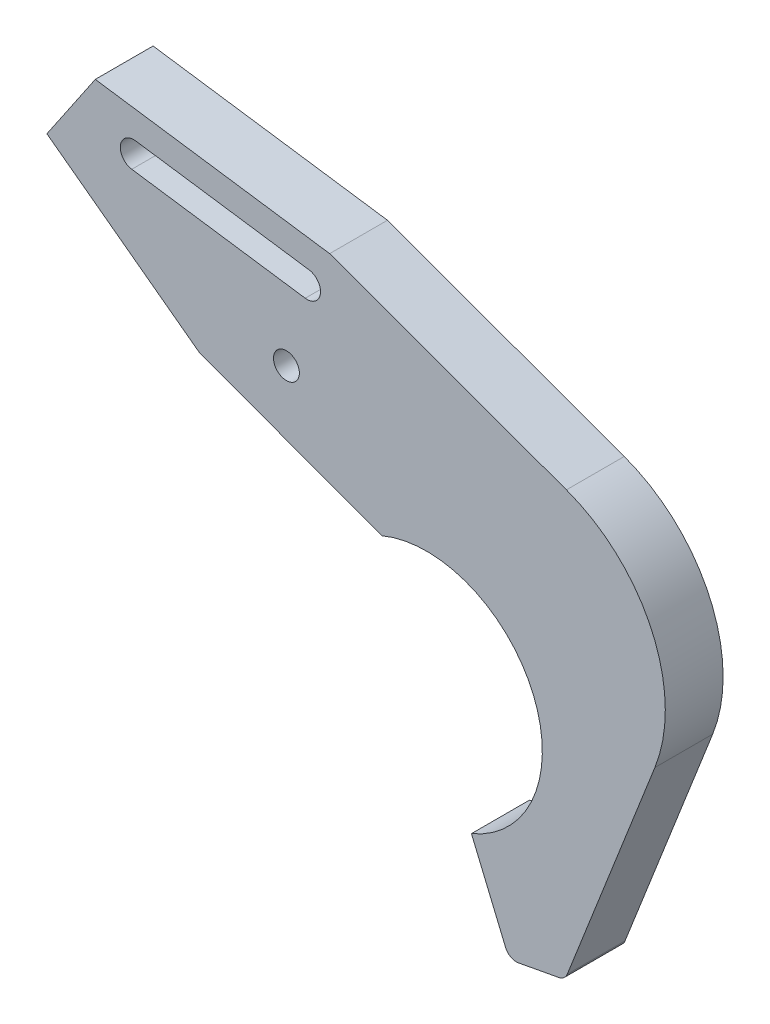
from build123d import *

# Parameters (mm, degrees)
SKETCH1_R           = 2.838382548
BOSS_EXTRUDE2_DEPTH = 12.7
FILLET5_R           = 33.02
FILLET7_R           = 2.54


with BuildPart() as part:
    # Sketch1 → Boss-Extrude2 (new body)
    with BuildSketch(Plane.XY):
        with BuildLine():
            Line((-21.603638559, 84.96960614), (29.87982891, 77.564224626))
            Line((29.87982891, 77.564224626), (113.413965473, 47.151661477))
            Line((113.413965473, 47.151661477), (109.035804568, 35.126174209))
            Line((109.035804568, 35.126174209), (95.280304394, 0.145728286))
            Line((95.280304394, 0.145728286), (81.56676708, -34.728005444))
            Line((81.56676708, -34.728005444), (69.33354083, -37.004919145))
            Line((69.33354083, -37.004919145), (61.026465875, -17.204201513))
            ThreePointArc((61.026465875, -17.204201513), (76.334091657, 9.884016708), (53.926809391, 31.471250781))
            ThreePointArc((53.926809391, 31.471250781), (47.534060902, 31.352091343), (41.37361205, 29.640278808))
            Line((41.37361205, 29.640278808), (1.321326785, 44.395112668))
            Line((1.321326785, 44.395112668), (-32.231275521, 69.307770201))
            Line((-32.231275521, 69.307770201), (-21.603638559, 84.96960614))
        make_face()
        with Locations((20.390142766, 51.502972215)):
            Circle(SKETCH1_R, mode=Mode.SUBTRACT)
        with BuildLine():
            Line((24.516957739, 66.398380962), (-13.583042261, 71.878684632))
            ThreePointArc((-13.583042261, 71.878684632), (-16.074090815, 75.206755234), (-12.746020212, 77.697803788))
            Line((-12.746020212, 77.697803788), (25.353979788, 72.217500118))
            ThreePointArc((25.353979788, 72.217500118), (27.845028342, 68.889429516), (24.516957739, 66.398380962))
        make_face(mode=Mode.SUBTRACT)
    extrude(amount=BOSS_EXTRUDE2_DEPTH)

    # Fillet5
    fillet5_edges = [part.edges().sort_by_distance(p)[0] for p in [
        (113.413965473, 47.151661477, 6.35),
    ]]
    fillet(fillet5_edges, radius=FILLET5_R)

    # Fillet7
    fillet7_edges = [part.edges().sort_by_distance(p)[0] for p in [
        (81.56676708, -34.728005444, 6.35),
        (69.33354083, -37.004919145, 6.35),
    ]]
    fillet(fillet7_edges, radius=FILLET7_R)


solid = part.part
